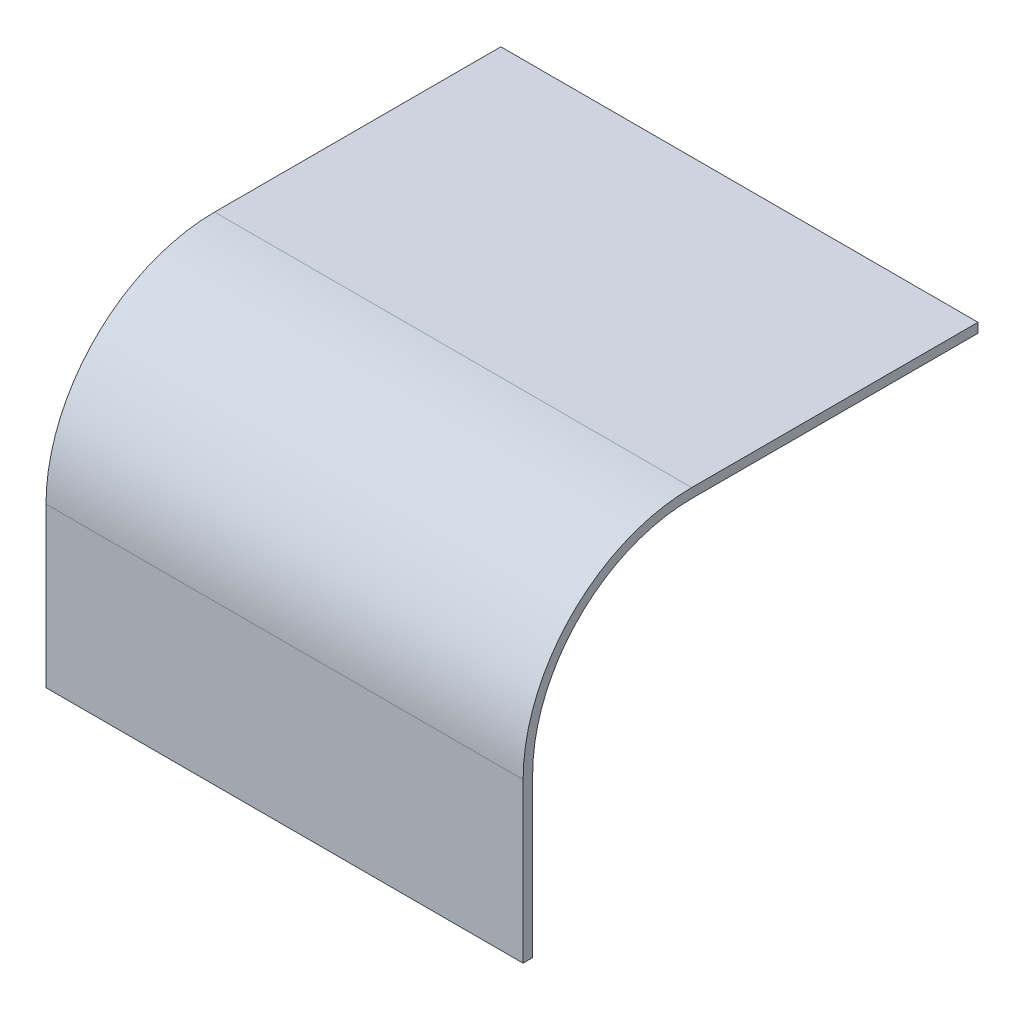
from build123d import *

# Parameters (mm, degrees)
SALIENTE_EXTRUIR1_DEPTH = 75


with BuildPart() as part:
    # Croquis1 → Saliente-Extruir1 (new, symmetric)
    with BuildSketch(Plane(origin=(-7.305693887, -32.456719669, 940.926254751), x_dir=(0, 0, -1), z_dir=(1, 0, 0))):
        with BuildLine():
            Line((-90, 100), (0, 100))
            Line((0, 100), (0, 103))
            Line((0, 103), (-90, 103))
            ThreePointArc((-90, 103), (-127.476659403, 87.476659403), (-143, 50))
            Line((-143, 50), (-143, 0))
            Line((-143, 0), (-140, 0))
            Line((-140, 0), (-140, 50))
            ThreePointArc((-140, 50), (-125.355339059, 85.355339059), (-90, 100))
        make_face()
    extrude(amount=SALIENTE_EXTRUIR1_DEPTH, both=True)


solid = part.part
